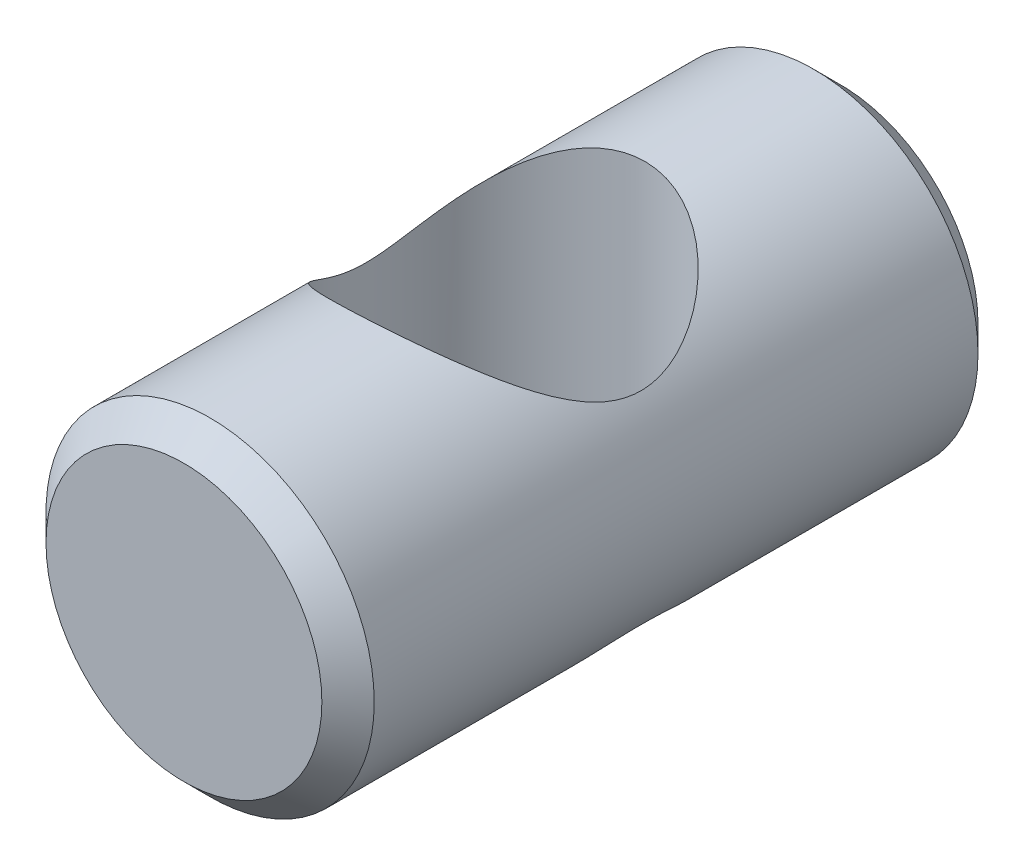
from build123d import *

# Parameters (mm, degrees)
SKETCH1_R               = 4.765
BOSS_EXTRUDE1_DEPTH     = 9.525
CHAMFER1_SIZE           = 0.76
CUT_EXTRUDE1_DEPTH      = 12.667736499
CUT_EXTRUDE1_DEPTH_BACK = 12.667736499
SKETCH2_R               = 4


with BuildPart() as part:
    # Sketch1 → Boss-Extrude1 (new, symmetric)
    with BuildSketch(Plane.XY):
        with Locations(Location((0, 0, 0), (0, 0, 180))):
            Circle(SKETCH1_R)
    extrude(amount=BOSS_EXTRUDE1_DEPTH, both=True)

    # Chamfer1
    chamfer1_edges = [part.edges().sort_by_distance(p)[0] for p in [
        (4.765, 0, -9.525),
        (4.765, 0, 9.525),
    ]]
    chamfer(chamfer1_edges, length=CHAMFER1_SIZE)

    # Sketch2 → Cut-Extrude1 (cut, two sides: drawn at the far end of the back side and taken through both)
    with BuildSketch(Plane(origin=(0, 0, 0), x_dir=(1, 0, 0), z_dir=(0, 1, 0)).offset(-CUT_EXTRUDE1_DEPTH_BACK)):
        with Locations(Location((-0.25, 0, 0), (0, 0, 270))):
            Circle(SKETCH2_R)
    extrude(amount=CUT_EXTRUDE1_DEPTH + CUT_EXTRUDE1_DEPTH_BACK, mode=Mode.SUBTRACT)


solid = part.part
